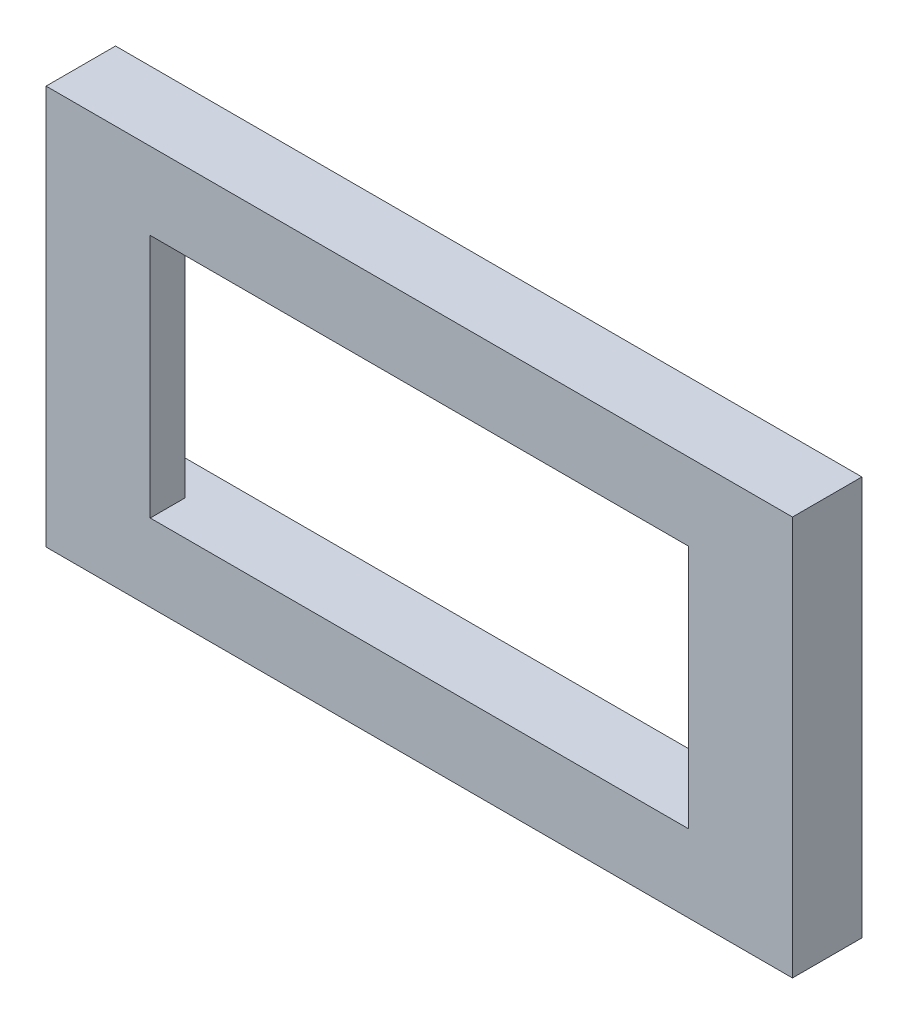
from build123d import *

# Parameters (mm, degrees)
SKETCH1_W           = 43
SKETCH1_H           = 23
SKETCH1_W_2         = 35
SKETCH1_H_2         = 14.1
BOSS_EXTRUDE1_DEPTH = 2
SKETCH2_W           = 43
SKETCH2_H           = 23
SKETCH2_W_2         = 31
SKETCH2_H_2         = 14.1
BOSS_EXTRUDE2_DEPTH = 2


with BuildPart() as part:
    # Sketch1 → Boss-Extrude1 (new body)
    with BuildSketch(Plane.XY):
        with Locations((21.5, 11.5)):
            Rectangle(SKETCH1_W, SKETCH1_H)
        with Locations((21.5, 11.5)):
            Rectangle(SKETCH1_W_2, SKETCH1_H_2, mode=Mode.SUBTRACT)
    extrude(amount=BOSS_EXTRUDE1_DEPTH)

    # Sketch2 → Boss-Extrude2 (add)
    with BuildSketch(Plane.XY.offset(2)):
        with Locations((21.5, 11.5)):
            Rectangle(SKETCH2_W, SKETCH2_H)
        with Locations((21.5, 11.5)):
            Rectangle(SKETCH2_W_2, SKETCH2_H_2, mode=Mode.SUBTRACT)
    extrude(amount=BOSS_EXTRUDE2_DEPTH)


solid = part.part
